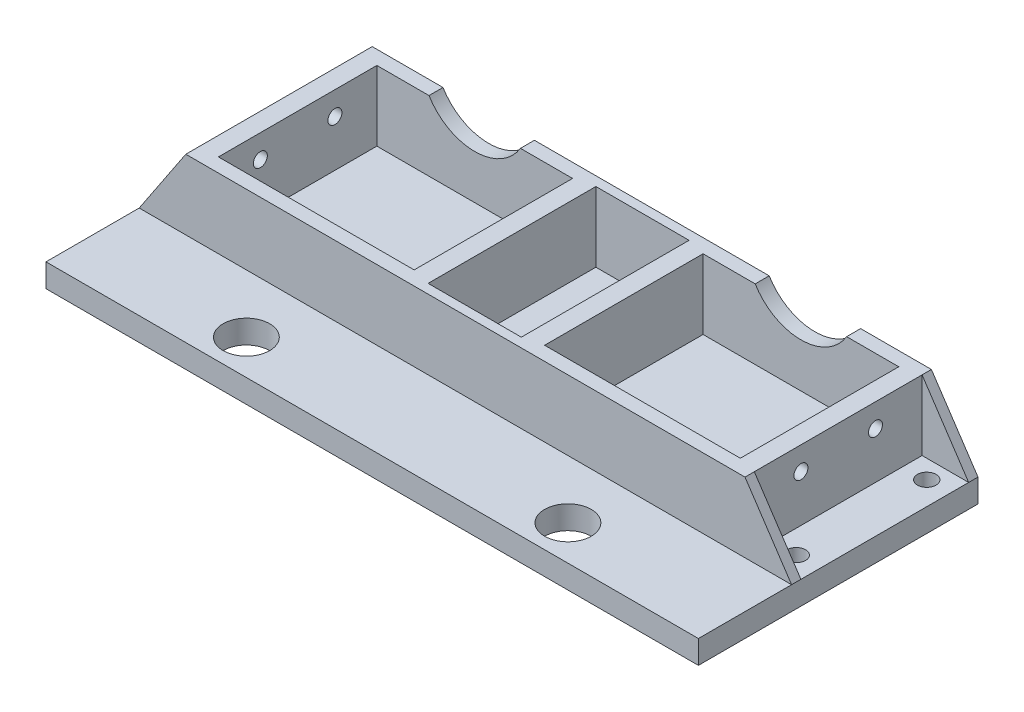
from build123d import *

# Parameters (mm, degrees)
SKETCH1_W               = 140
SKETCH1_H               = 40
BOSS_EXTRUDE1_DEPTH     = 20
SKETCH2_W               = 10
SKETCH2_H               = 40
SKETCH2_W_2             = 20
SKETCH2_W_3             = 42
SKETCH2_H_2             = 34
CUT_EXTRUDE1_DEPTH      = 15
SKETCH3_R               = 1.5
CUT_EXTRUDE2_DEPTH      = 15
SKETCH4_R               = 11.5
CUT_EXTRUDE3_DEPTH      = 3
SKETCH5_R               = 2
CUT_EXTRUDE4_DEPTH      = 5
SKETCH6_W               = 140
SKETCH6_H               = 5
BOSS_EXTRUDE2_DEPTH     = 20
SKETCH7_R               = 5
CUT_EXTRUDE5_DEPTH      = 5
SKETCH8_W               = 20
SKETCH8_H               = 15
BOSS_EXTRUDE3_DEPTH     = 2
LPATTERN1_COUNT         = 2
LPATTERN1_PITCH         = 38
MIRROR2_COPY_1_SKETCH_W = 20
MIRROR2_COPY_1_SKETCH_H = 15
MIRROR2_COPY_1_DEPTH    = 2


with BuildPart() as part:
    # Sketch1 → Boss-Extrude1 (new body)
    with BuildSketch(Plane(origin=(0, 0, 0), x_dir=(1, 0, 0), z_dir=(0, 1, 0))):
        Rectangle(SKETCH1_W, SKETCH1_H)
    extrude(amount=BOSS_EXTRUDE1_DEPTH)

    # Sketch2 → Cut-Extrude1 (cut)
    with BuildSketch(Plane(origin=(0, 20, 0), x_dir=(1, 0, 0), z_dir=(0, 1, 0))):
        with Locations((-65, 0)):
            Rectangle(SKETCH2_W, SKETCH2_H)
        with Locations((65, 0)):
            Rectangle(SKETCH2_W, SKETCH2_H)
        Rectangle(SKETCH2_W_2, SKETCH2_H)
        with Locations((-35, 0)):
            Rectangle(SKETCH2_W_3, SKETCH2_H_2)
        with Locations((35, 0)):
            Rectangle(SKETCH2_W_3, SKETCH2_H_2)
    extrude(amount=-CUT_EXTRUDE1_DEPTH, mode=Mode.SUBTRACT)

    # Sketch3 → Cut-Extrude2 (cut)
    with BuildSketch(Plane.ZY.offset(60)):
        with Locations((-8, 15)):
            Circle(SKETCH3_R)
        with Locations((8, 15)):
            Circle(SKETCH3_R)
    cut_extrude2 = extrude(amount=-CUT_EXTRUDE2_DEPTH, mode=Mode.SUBTRACT)

    # Sketch4 → Cut-Extrude3 (cut)
    with BuildSketch(Plane(origin=(0, 0, -20), x_dir=(-1, 0, 0), z_dir=(0, 0, -1))):
        with Locations((35, 26)):
            Circle(SKETCH4_R)
        with Locations((-35, 26)):
            Circle(SKETCH4_R)
    extrude(amount=-CUT_EXTRUDE3_DEPTH, mode=Mode.SUBTRACT)

    # Sketch5 → Cut-Extrude4 (cut)
    with BuildSketch(Plane(origin=(0, 5, 0), x_dir=(1, 0, 0), z_dir=(0, 1, 0))):
        with Locations(Location((-65, 14, 0), (0, 0, 270))):
            Circle(SKETCH5_R)
        with Locations(Location((-65, -14, 0), (0, 0, 270))):
            Circle(SKETCH5_R)
    cut_extrude4 = extrude(amount=-CUT_EXTRUDE4_DEPTH, mode=Mode.SUBTRACT)

    # Mirror1: Cut-Extrude2, Cut-Extrude4 across plane
    add(cut_extrude2.mirror(Plane(origin=(0, 0, 0), x_dir=(0, 0, 1), z_dir=(1, 0, 0))), mode=Mode.SUBTRACT)
    add(cut_extrude4.mirror(Plane(origin=(0, 0, 0), x_dir=(0, 0, 1), z_dir=(1, 0, 0))), mode=Mode.SUBTRACT)

    # Sketch6 → Boss-Extrude2 (add)
    with BuildSketch(Plane.XY.offset(20)):
        with Locations((0, 2.5)):
            Rectangle(SKETCH6_W, SKETCH6_H)
    extrude(amount=BOSS_EXTRUDE2_DEPTH)

    # Sketch7 → Cut-Extrude5 (cut)
    with BuildSketch(Plane(origin=(0, 5, 0), x_dir=(1, 0, 0), z_dir=(0, 1, 0))):
        with Locations(Location((-34.5, -32.5, 0), (0, 0, 270))):
            Circle(SKETCH7_R)
        with Locations(Location((34.5, -32.5, 0), (0, 0, 270))):
            Circle(SKETCH7_R)
    extrude(amount=-CUT_EXTRUDE5_DEPTH, mode=Mode.SUBTRACT)

    # Sketch8 → Boss-Extrude3 (add)
    with BuildSketch(Plane.XY.offset(20)):
        Polygon((-60, 20), (-70, 5), (-60, 5), align=None)
        with Locations((0, 12.5)):
            Rectangle(SKETCH8_W, SKETCH8_H)
    boss_extrude3 = extrude(amount=-BOSS_EXTRUDE3_DEPTH)

    # LPattern1: Boss-Extrude3 ×2
    with Locations(*[(0, 0, -i * LPATTERN1_PITCH) for i in range(1, LPATTERN1_COUNT)]):
        add(boss_extrude3)

    # Mirror2: Boss-Extrude3 across plane
    add(boss_extrude3.mirror(Plane(origin=(0, 0, 0), x_dir=(0, 0, 1), z_dir=(1, 0, 0))))

    # Mirror2 copy 1 sketch → Mirror2 copy 1 (add)
    with BuildSketch(Plane(origin=(0, 0, -18), x_dir=(-1, 0, 0), z_dir=(0, 0, 1))):
        Polygon((-60, -20), (-70, -5), (-60, -5), align=None)
        with Locations((0, -12.5)):
            Rectangle(MIRROR2_COPY_1_SKETCH_W, MIRROR2_COPY_1_SKETCH_H)
    extrude(amount=-MIRROR2_COPY_1_DEPTH)


solid = part.part
